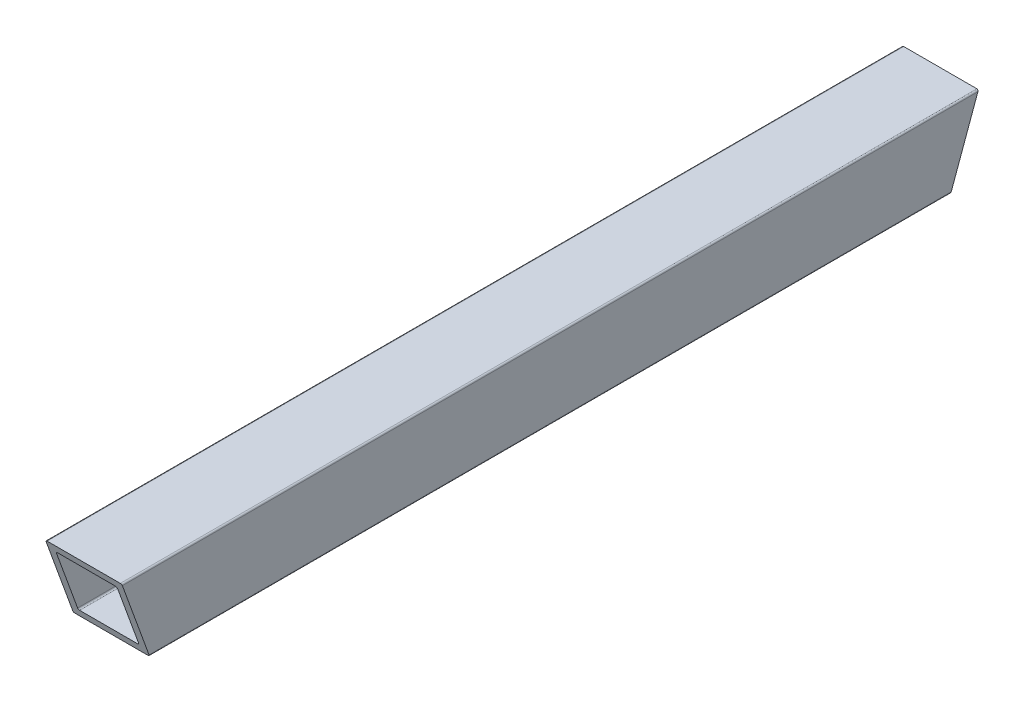
from build123d import *

# Parameters (mm, degrees)
SKETCH_1_W          = 10
SKETCH_1_H          = 10
SKETCH_1_W_2        = 8
SKETCH_1_H_2        = 8
EXTRUDE_1_DEPTH     = 200
FILLET_1_R          = 0.2
CUT_EXTRUDE_1_DEPTH = 201.31225624
CUT_EXTRUDE_2_DEPTH = 201.31225624


with BuildPart() as part:
    # 草圖1 → 填料-伸長1 (new body)
    with BuildSketch(Plane.XY):
        Rectangle(SKETCH_1_W, SKETCH_1_H)
        Rectangle(SKETCH_1_W_2, SKETCH_1_H_2, mode=Mode.SUBTRACT)
    extrude(amount=EXTRUDE_1_DEPTH)

    # 圓角1
    fillet_1_edges = [part.edges().sort_by_distance(p)[0] for p in [
        (-4, 4, 100),
        (-4, -4, 100),
        (4, -4, 100),
        (4, 4, 100),
        (-5, 5, 100),
        (5, 5, 100),
        (5, -5, 100),
        (-5, -5, 100),
    ]]
    fillet(fillet_1_edges, radius=FILLET_1_R)

    # 草圖2 → 除料-伸長1 (cut, through all)
    with BuildSketch(Plane(origin=(5, 0, 0), x_dir=(0, 0, -1), z_dir=(1, 0, 0))):
        Polygon((0, 5), (0, -5), (-3.639702343, -5), align=None)
    extrude(amount=-CUT_EXTRUDE_1_DEPTH, mode=Mode.SUBTRACT)

    # 草圖3 → 除料-伸長2 (cut, through all)
    with BuildSketch(Plane(origin=(5, 0, 0), x_dir=(0, 0, -1), z_dir=(1, 0, 0))):
        Polygon((-108.639702343, -5), (-112.279404685, 5), (-200, 5), (-200, -5), align=None)
    extrude(amount=-CUT_EXTRUDE_2_DEPTH, mode=Mode.SUBTRACT)


solid = part.part
